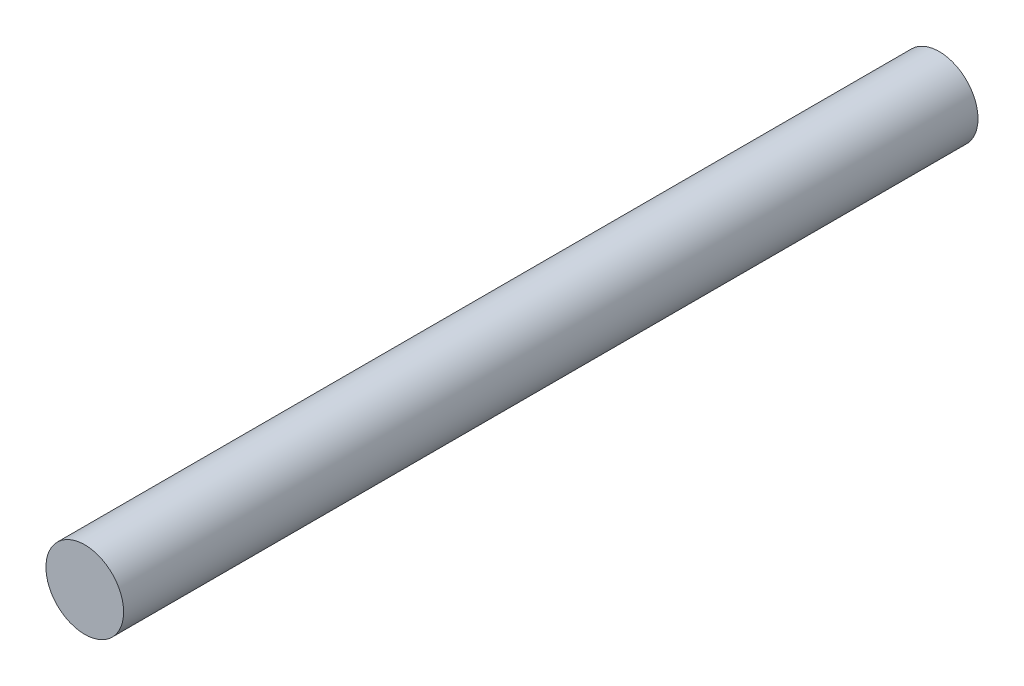
from build123d import *

# Parameters (mm, degrees)
SKETCH1_R           = 5
BOSS_EXTRUDE1_DEPTH = 110


with BuildPart() as part:
    # Sketch1 → Boss-Extrude1 (new body)
    with BuildSketch(Plane.XY):
        Circle(SKETCH1_R)
    extrude(amount=BOSS_EXTRUDE1_DEPTH)


solid = part.part
